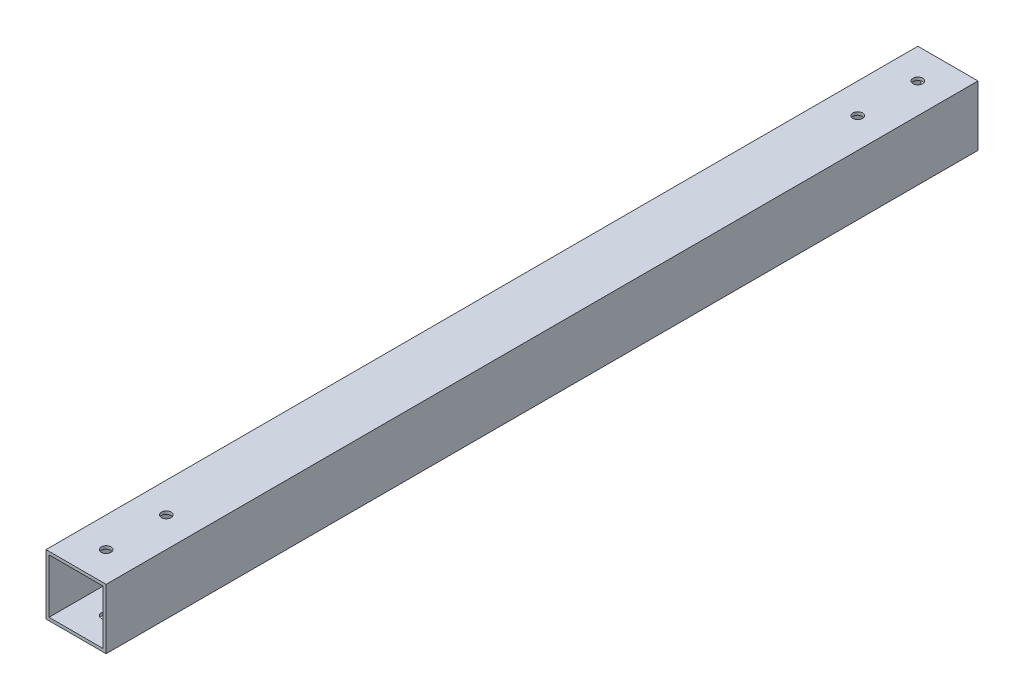
from build123d import *

# Parameters (mm, degrees)
SKETCH_1_W          = 20
SKETCH_1_H          = 20
SKETCH_1_W_2        = 18
SKETCH_1_H_2        = 18
EXTRUDE_1_DEPTH     = 290
SKETCH_2_R          = 1.6
CUT_EXTRUDE_1_DEPTH = 292.376045687


with BuildPart() as part:
    # 草图1 → 拉伸-薄壁1 (new body)
    with BuildSketch(Plane.XY):
        with Locations((10, -10)):
            Rectangle(SKETCH_1_W, SKETCH_1_H)
        with Locations((10, -10)):
            Rectangle(SKETCH_1_W_2, SKETCH_1_H_2, mode=Mode.SUBTRACT)
    extrude(amount=EXTRUDE_1_DEPTH)

    # 草图2 → 切除-拉伸1 (cut, through all)
    with BuildSketch(Plane(origin=(0, 0, 0), x_dir=(1, 0, 0), z_dir=(0, 1, 0))):
        with Locations(Location((10, -280, 0), (0, 0, 270))):
            Circle(SKETCH_2_R)
        with Locations(Location((10, -260, 0), (0, 0, 270))):
            Circle(SKETCH_2_R)
        with Locations(Location((10, -30, 0), (0, 0, 270))):
            Circle(SKETCH_2_R)
        with Locations(Location((10, -10, 0), (0, 0, 270))):
            Circle(SKETCH_2_R)
    extrude(amount=-CUT_EXTRUDE_1_DEPTH, mode=Mode.SUBTRACT)


solid = part.part
